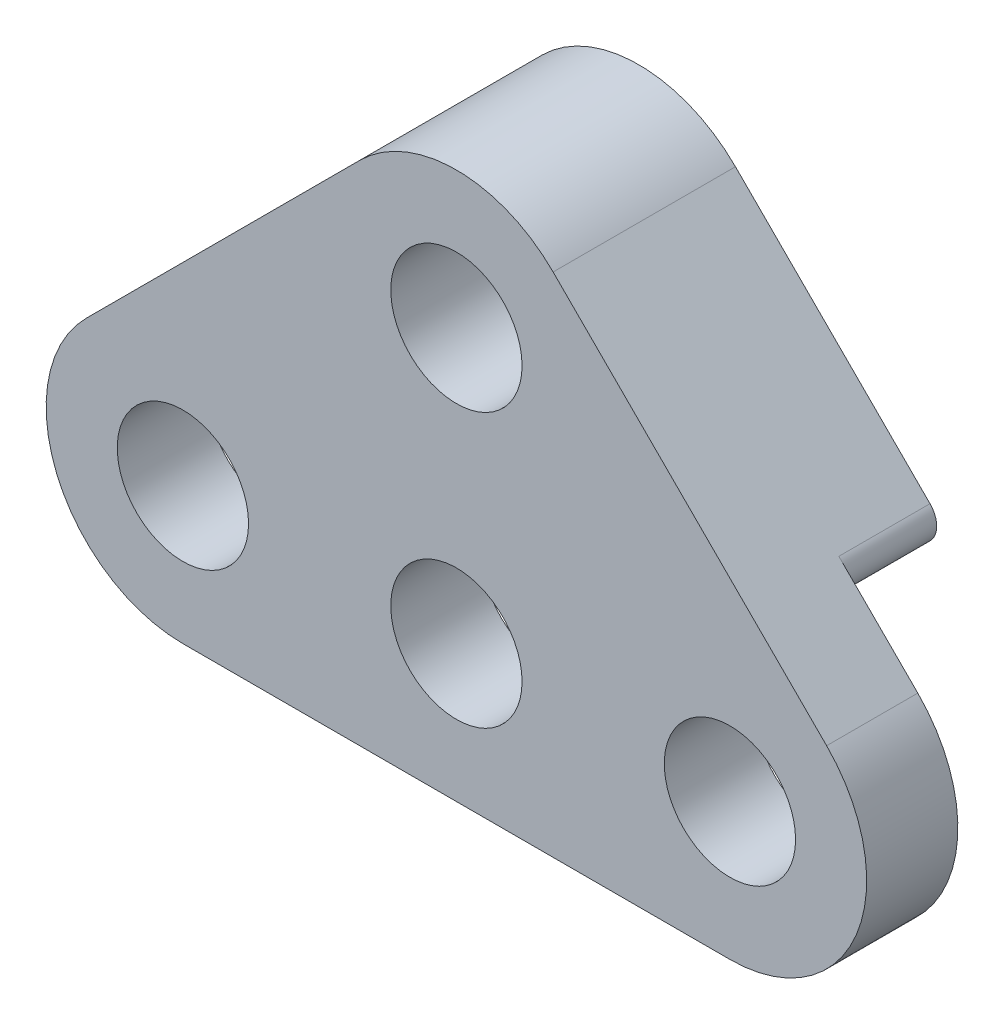
from build123d import *

# Parameters (mm, degrees)
SKETCH1_R           = 2.286
SKETCH1_R_2         = 2.2859999999999996
BOSS_EXTRUDE1_DEPTH = 3.175
BOSS_EXTRUDE2_START = -3.175
SKETCH1_4_R         = 2.2859999999999996
BOSS_EXTRUDE2_DEPTH = 3.175
FILLET1_R           = 0.79375


with BuildPart() as part:
    # Sketch1 → Boss-Extrude1 (new body)
    with BuildSketch(Plane.XY):
        with BuildLine():
            ThreePointArc((-12.89259604540093, 3.3675960454009317), (-13.924976273585003, -1.82252984663874), (-9.524999999999999, -4.762500000000001))
            Line((-9.525, -4.7625), (9.525, -4.762499999999998))
            ThreePointArc((9.525, -4.762499999999998), (13.924976273585004, -1.8225298466387378), (12.892596045400932, 3.3675960454009357))
            Line((12.892596045400932, 3.3675960454009357), (3.3675960454009335, 12.892596045400932))
            ThreePointArc((3.3675960454009344, 12.892596045400932), (2.66e-15, 14.287499999999998), (-3.367596045400929, 12.892596045400932))
            Line((-3.367596045400929, 12.892596045400932), (-12.892596045400932, 3.3675960454009317))
        make_face()
        with Locations((-9.525, 0)):
            Circle(SKETCH1_R, mode=Mode.SUBTRACT)
        Circle(SKETCH1_R, mode=Mode.SUBTRACT)
        with Locations((9.525, 3.5e-15)):
            Circle(SKETCH1_R, mode=Mode.SUBTRACT)
        with Locations((2.6e-15, 9.525)):
            Circle(SKETCH1_R_2, mode=Mode.SUBTRACT)
    extrude(amount=BOSS_EXTRUDE1_DEPTH)

    # Sketch1<4> → Boss-Extrude2 (add)
    with BuildSketch(Plane.XY.offset(BOSS_EXTRUDE2_START)):
        with BuildLine():
            Line((-3.367596045400928, 12.892596045400932), (-11.49769209080186, 4.762500000000003))
            Line((-11.49769209080186, 4.762500000000004), (11.497692090801866, 4.762500000000003))
            Line((11.497692090801866, 4.762500000000002), (3.3675960454009335, 12.892596045400932))
            ThreePointArc((3.3675960454009344, 12.892596045400932), (2.66e-15, 14.287499999999998), (-3.367596045400929, 12.892596045400932))
        make_face()
        with Locations((2.6e-15, 9.525)):
            Circle(SKETCH1_4_R, mode=Mode.SUBTRACT)
    extrude(amount=BOSS_EXTRUDE2_DEPTH)

    # Fillet1
    fillet1_edges = [part.edges().sort_by_distance(p)[0] for p in [
        (-11.49769209080186, 4.762500000000003, -1.5875),
        (11.497692090801866, 4.762500000000003, -1.5875),
    ]]
    fillet(fillet1_edges, radius=FILLET1_R)


solid = part.part
